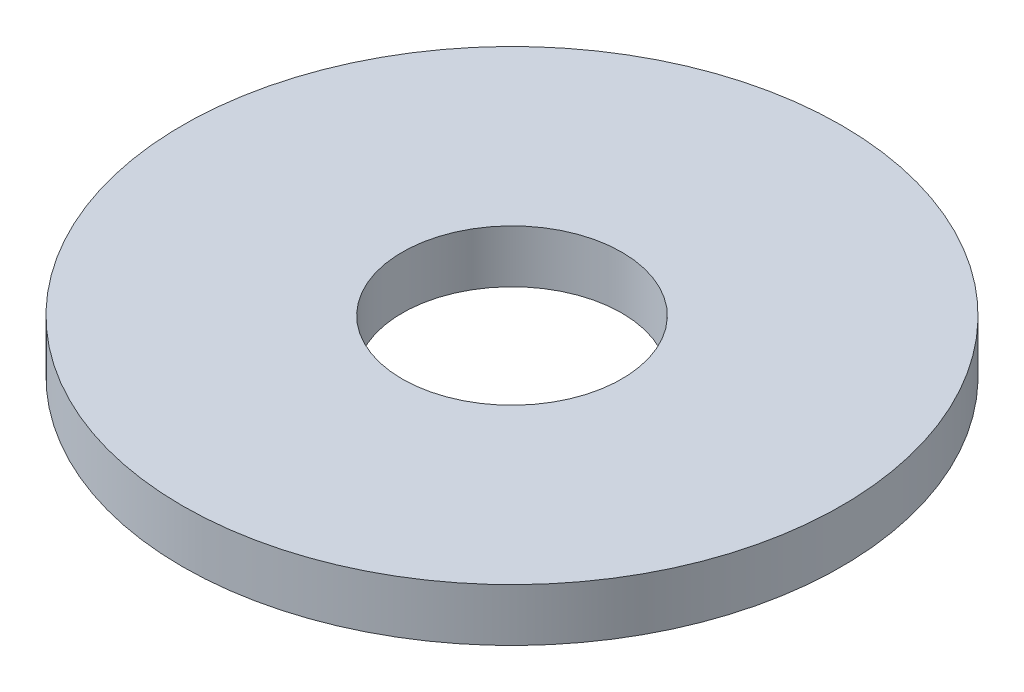
from build123d import *

# Parameters (mm, degrees)
SKETCH1_R           = 7.5
SKETCH1_R_2         = 2.5
BOSS_EXTRUDE1_DEPTH = 1.2


with BuildPart() as part:
    # Sketch1 → Boss-Extrude1 (new body)
    with BuildSketch(Plane(origin=(0, 0, 0), x_dir=(1, 0, 0), z_dir=(0, 1, 0))):
        with Locations(Location((0, 0, 0), (0, 0, 270))):
            Circle(SKETCH1_R)
        with Locations(Location((0, 0, 0), (0, 0, 270))):
            Circle(SKETCH1_R_2, mode=Mode.SUBTRACT)
    extrude(amount=BOSS_EXTRUDE1_DEPTH)


solid = part.part
